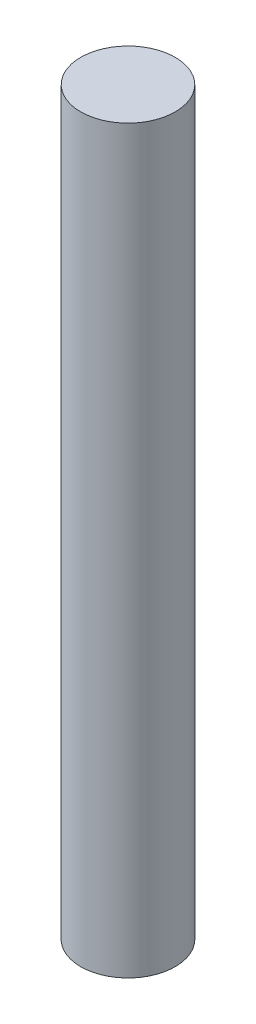
from build123d import *

# Parameters (mm, degrees)
SKETCH1_R           = 6
BOSS_EXTRUDE1_DEPTH = 94


with BuildPart() as part:
    # Sketch1 → Boss-Extrude1 (new body)
    with BuildSketch(Plane(origin=(0, 0, 0), x_dir=(1, 0, 0), z_dir=(0, 1, 0))):
        with Locations(Location((0, 0, 0), (0, 0, 270))):
            Circle(SKETCH1_R)
    extrude(amount=BOSS_EXTRUDE1_DEPTH)


solid = part.part
